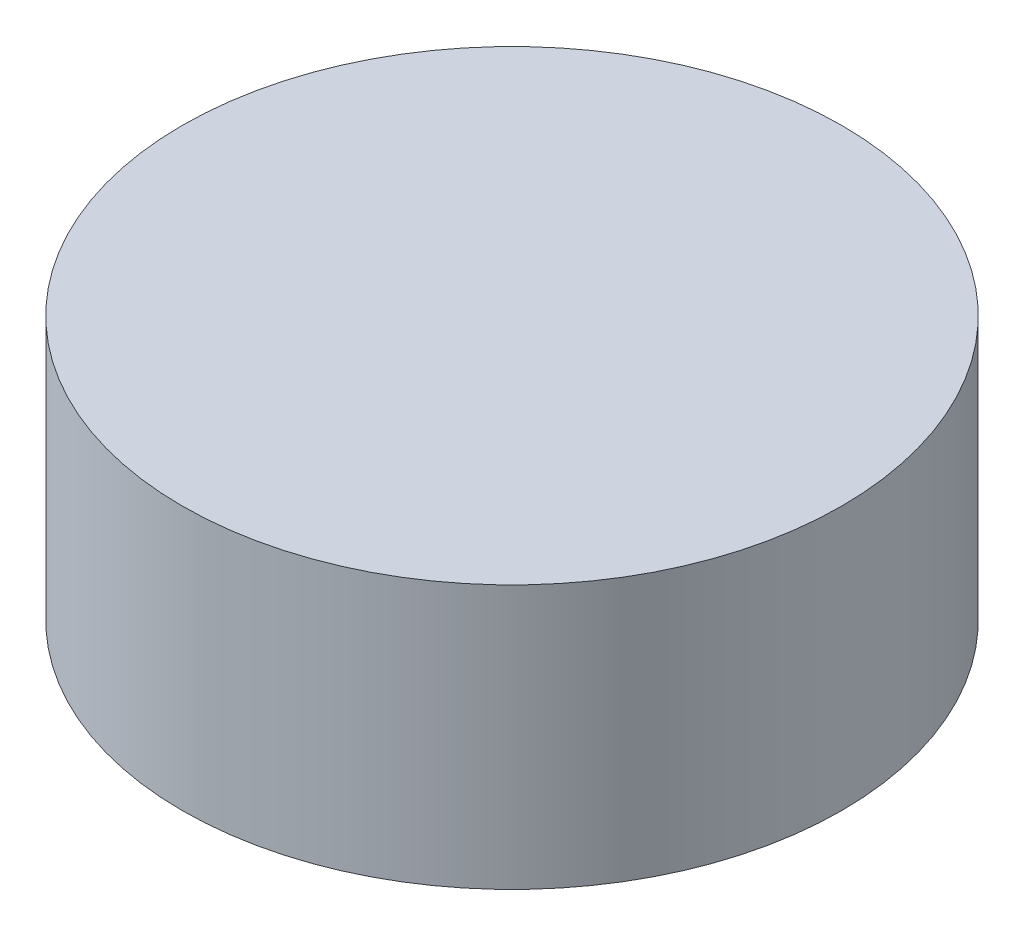
from build123d import *

# Parameters (mm, degrees)
SKETCH1_R           = 125
BOSS_EXTRUDE1_DEPTH = 50


with BuildPart() as part:
    # Sketch1 → Boss-Extrude1 (new, symmetric)
    with BuildSketch(Plane(origin=(0, 0, 0), x_dir=(1, 0, 0), z_dir=(0, 1, 0))):
        with Locations(Location((0, 0, 0), (0, 0, 270))):
            Circle(SKETCH1_R)
    extrude(amount=BOSS_EXTRUDE1_DEPTH, both=True)


solid = part.part
